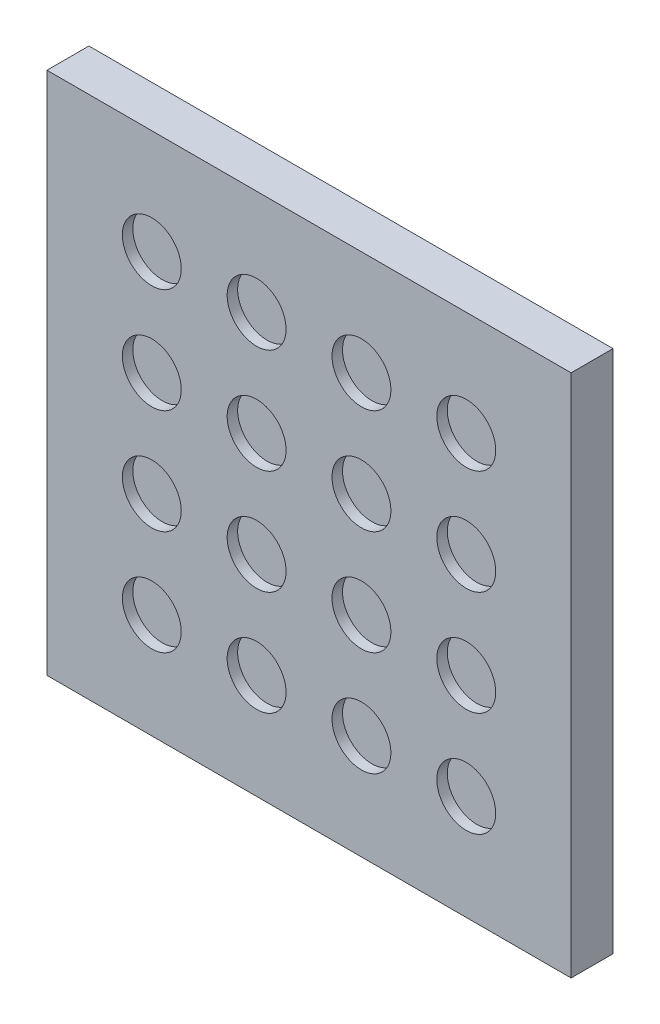
from build123d import *

# Parameters (mm, degrees)
SKETCH1_W           = 50
SKETCH1_H           = 50
SKETCH1_R           = 2.81
BOSS_EXTRUDE1_DEPTH = 1
SKETCH2_W           = 50
SKETCH2_H           = 50
BOSS_EXTRUDE2_DEPTH = 3


with BuildPart() as part:
    # Sketch1 → Boss-Extrude1 (new body)
    with BuildSketch(Plane.XY):
        with Locations((15, -15)):
            Rectangle(SKETCH1_W, SKETCH1_H)
        Circle(SKETCH1_R, mode=Mode.SUBTRACT)
        with Locations((10, 0)):
            Circle(SKETCH1_R, mode=Mode.SUBTRACT)
        with Locations((20, 0)):
            Circle(SKETCH1_R, mode=Mode.SUBTRACT)
        with Locations((30, 0)):
            Circle(SKETCH1_R, mode=Mode.SUBTRACT)
        with Locations((10, -10)):
            Circle(SKETCH1_R, mode=Mode.SUBTRACT)
        with Locations((20, -10)):
            Circle(SKETCH1_R, mode=Mode.SUBTRACT)
        with Locations((30, -10)):
            Circle(SKETCH1_R, mode=Mode.SUBTRACT)
        with Locations((10, -20)):
            Circle(SKETCH1_R, mode=Mode.SUBTRACT)
        with Locations((20, -20)):
            Circle(SKETCH1_R, mode=Mode.SUBTRACT)
        with Locations((30, -20)):
            Circle(SKETCH1_R, mode=Mode.SUBTRACT)
        with Locations((10, -30)):
            Circle(SKETCH1_R, mode=Mode.SUBTRACT)
        with Locations((20, -30)):
            Circle(SKETCH1_R, mode=Mode.SUBTRACT)
        with Locations((30, -30)):
            Circle(SKETCH1_R, mode=Mode.SUBTRACT)
        with Locations((0, -10)):
            Circle(SKETCH1_R, mode=Mode.SUBTRACT)
        with Locations((0, -20)):
            Circle(SKETCH1_R, mode=Mode.SUBTRACT)
        with Locations((0, -30)):
            Circle(SKETCH1_R, mode=Mode.SUBTRACT)
    extrude(amount=BOSS_EXTRUDE1_DEPTH)

    # Sketch2 → Boss-Extrude2 (add)
    with BuildSketch(Plane(origin=(0, 0, 0), x_dir=(-1, 0, 0), z_dir=(0, 0, -1))):
        with Locations((-15, -15)):
            Rectangle(SKETCH2_W, SKETCH2_H)
    extrude(amount=BOSS_EXTRUDE2_DEPTH)


solid = part.part
